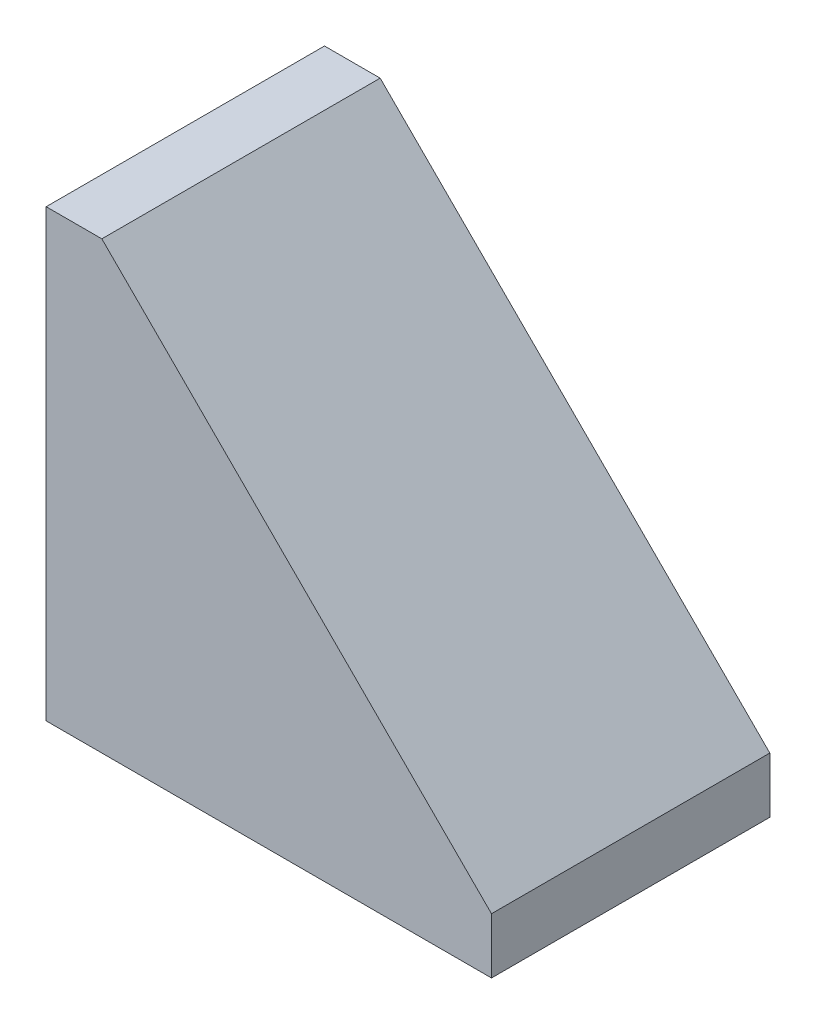
from build123d import *

# Parameters (mm, degrees)
BOSS_EXTRUDE1_DEPTH = 15.875


with BuildPart() as part:
    # Sketch1 → Boss-Extrude1 (new body)
    with BuildSketch(Plane.XY):
        Polygon((0, 0), (0, 25.4), (3.175, 25.4), (25.4, 3.175), (25.4, 0), align=None)
    extrude(amount=BOSS_EXTRUDE1_DEPTH)


solid = part.part
